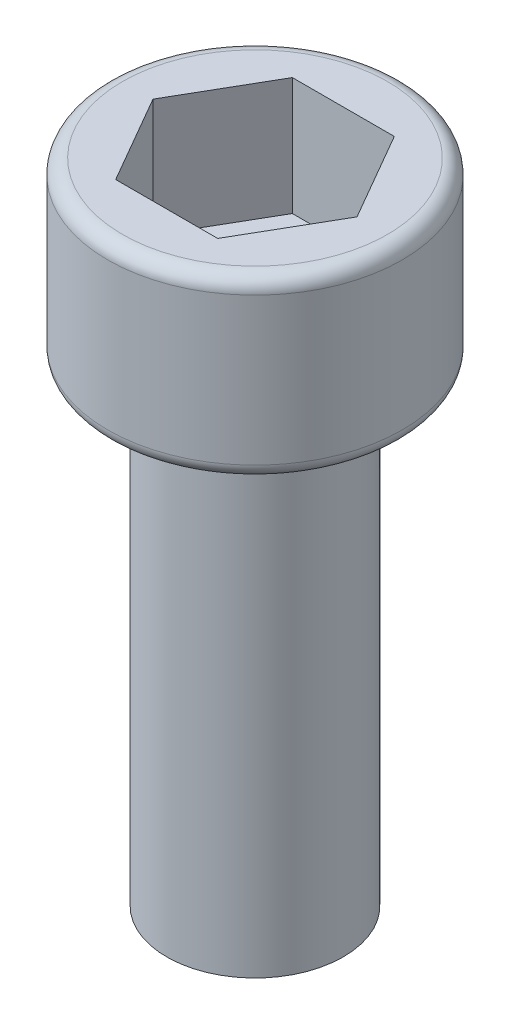
from build123d import *

# Parameters (mm, degrees)
CUT_EXTRUDE1_DEPTH = 2
FILLET1_R          = 0.25


with BuildPart() as part:
    # Sketch1 → Revolve1 (revolve)
    with BuildSketch(Plane.XY):
        Polygon((0, -5.5), (1.5, -5.5), (1.5, 2.5), (2.5, 2.5), (2.5, 5.5), (0, 5.5), align=None)
    revolve(axis=Axis((0, -1000, 0), (0, 1, 0)))

    # Sketch2 → Cut-Extrude1 (cut)
    with BuildSketch(Plane(origin=(0, 5.5, 0), x_dir=(1, 0, 0), z_dir=(0, 1, 0))):
        Polygon((0.866025404, 1.5), (-0.866025404, 1.5), (-1.732050808, 0), (-0.866025404, -1.5), (0.866025404, -1.5), (1.732050808, 0), align=None)
    extrude(amount=-CUT_EXTRUDE1_DEPTH, mode=Mode.SUBTRACT)

    # Fillet1
    fillet1_edges = [part.edges().sort_by_distance(p)[0] for p in [
        (-2.5, 5.5, 0),
        (-2.5, 2.5, 0),
    ]]
    fillet(fillet1_edges, radius=FILLET1_R)


solid = part.part
